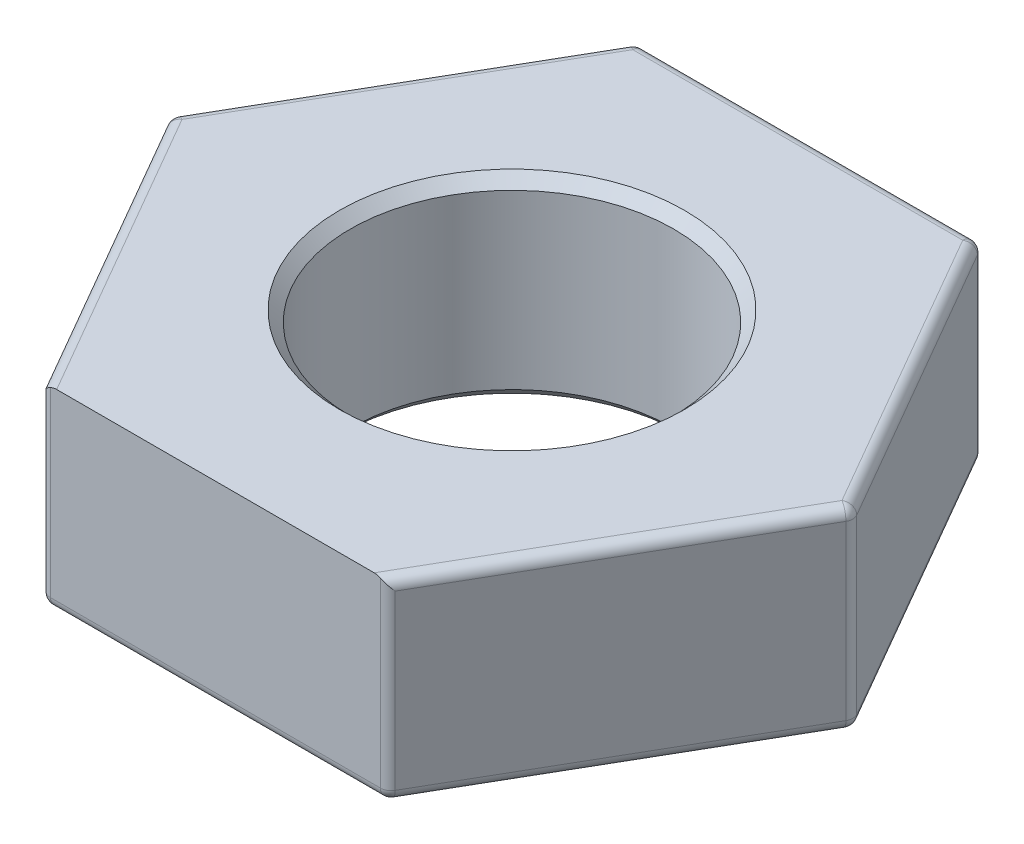
from build123d import *

# Parameters (mm, degrees)
SKETCH1_R           = 2.75
SKETCH1_R_2         = 1.5
BOSS_EXTRUDE2_DEPTH = 1.8
FILLET1_R           = 0.1
CHAMFER1_SIZE       = 0.1


with BuildPart() as part:
    # Sketch1 → Boss-Extrude2 (new body)
    # profile 1 of 7: a face of its own
    with BuildSketch(Plane(origin=(0, 0, 0), x_dir=(1, 0, 0), z_dir=(0, 1, 0))):
        with BuildLine():
            Line((0, 2.75), (-1.58771324, 2.75))
            Line((-1.58771324, 2.75), (-2.381569814, 1.37500008))
            ThreePointArc((-2.381569814, 1.37500008), (-1.37499996, 2.381569884), (0, 2.75))
        make_face()
    # profile 2 of 7: a face of its own
    with BuildSketch(Plane(origin=(0, 0, 0), x_dir=(1, 0, 0), z_dir=(0, 1, 0))):
        with BuildLine():
            ThreePointArc((-2.381569844, -1.375000029), (-2.75, 3e-08), (-2.381569814, 1.37500008))
            Line((-2.381569814, 1.37500008), (-3.175426481, 0))
            Line((-3.175426481, 0), (-2.381569844, -1.375000029))
        make_face()
    # profile 3 of 7: a face of its own
    with BuildSketch(Plane(origin=(0, 0, 0), x_dir=(1, 0, 0), z_dir=(0, 1, 0))):
        with BuildLine():
            Line((1.58771324, 2.75), (0, 2.75))
            ThreePointArc((0, 2.75), (1.374999954, 2.381569887), (2.381569807, 1.375000092))
            Line((2.381569807, 1.375000092), (1.58771324, 2.75))
        make_face()
    # profile 4 of 7: a face of its own
    with BuildSketch(Plane(origin=(0, 0, 0), x_dir=(1, 0, 0), z_dir=(0, 1, 0))):
        with BuildLine():
            Line((3.175426481, 0), (2.381569807, 1.375000092))
            ThreePointArc((2.381569807, 1.375000092), (2.656296008, 0.711752426), (2.75, 0))
            ThreePointArc((2.75, 0), (2.65629601, -0.711752419), (2.381569814, -1.37500008))
            Line((2.381569814, -1.37500008), (3.175426481, 0))
        make_face()
    # profile 5 of 7: a face of its own
    with BuildSketch(Plane(origin=(0, 0, 0), x_dir=(1, 0, 0), z_dir=(0, 1, 0))):
        with BuildLine():
            ThreePointArc((0, -2.75), (-1.374999986, -2.381569869), (-2.381569844, -1.375000029))
            Line((-2.381569844, -1.375000029), (-1.58771324, -2.75))
            Line((-1.58771324, -2.75), (0, -2.75))
        make_face()
    # profile 6 of 7: a face of its own
    with BuildSketch(Plane(origin=(0, 0, 0), x_dir=(1, 0, 0), z_dir=(0, 1, 0))):
        with BuildLine():
            ThreePointArc((2.381569814, -1.37500008), (1.37499996, -2.381569884), (0, -2.75))
            Line((0, -2.75), (1.58771324, -2.75))
            Line((1.58771324, -2.75), (2.381569814, -1.37500008))
        make_face()
    # profile 7 of 7: a face of its own
    with BuildSketch(Plane(origin=(0, 0, 0), x_dir=(1, 0, 0), z_dir=(0, 1, 0))):
        Circle(SKETCH1_R)
        with Locations(Location((0, 0, 0), (0, 0, 270))):
            Circle(SKETCH1_R_2, mode=Mode.SUBTRACT)
    extrude(amount=BOSS_EXTRUDE2_DEPTH)

    # Fillet1
    fillet1_edges = [part.edges().sort_by_distance(p)[0] for p in [
        (2.38156986, 0, -1.375),
        (2.38156986, 0, 1.375),
        (0, 0, 2.75),
        (-2.38156986, 1.8, 1.375),
        (-2.38156986, 0, 1.375),
        (-2.38156986, 0, -1.375),
        (-1.58771324, 0.9, -2.75),
        (1.58771324, 0.9, -2.75),
        (3.175426481, 0.9, 0),
        (1.58771324, 0.9, 2.75),
        (-1.58771324, 0.9, 2.75),
        (-3.175426481, 0.9, 0),
        (2.38156986, 1.8, 1.375),
        (2.38156986, 1.8, -1.375),
        (0, 1.8, -2.75),
        (-2.38156986, 1.8, -1.375),
        (0, 0, -2.75),
    ]]
    fillet(fillet1_edges, radius=FILLET1_R)

    # Chamfer1
    chamfer1_edges = [part.edges().sort_by_distance(p)[0] for p in [
        (0, 1.8, -1.5),
        (0, 0, -1.5),
    ]]
    chamfer(chamfer1_edges, length=CHAMFER1_SIZE)


solid = part.part
